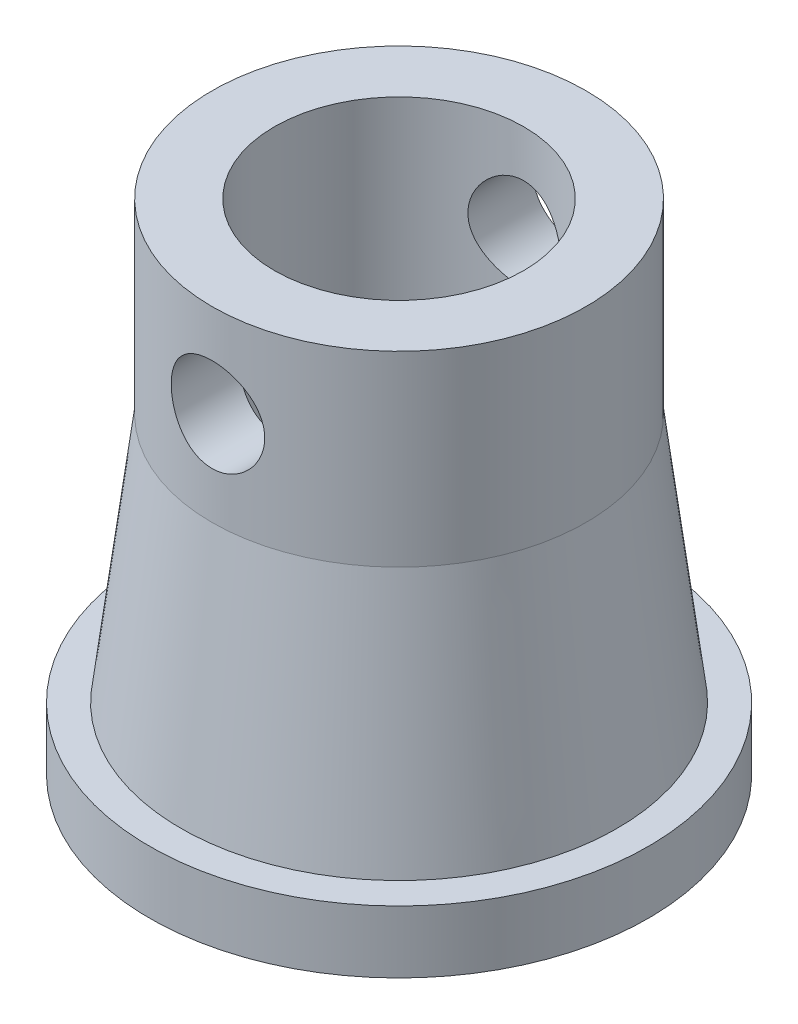
from build123d import *

# Parameters (mm, degrees)
SKETCH2_R          = 7.5
CUT_EXTRUDE1_DEPTH = 35


with BuildPart() as part:
    # Sketch1 → Revolve1 (revolve)
    with BuildSketch(Plane.XY, mode=Mode.PRIVATE) as revolve1_sk:
        Polygon((20, 0), (20, 80), (30, 80), (30, 50), (35, 10), (40, 10), (40, 0), align=None)
    revolve(revolve1_sk.sketch.rotate(Axis((0, 0, 0), (0, 1, 0)), 90), axis=Axis((0, 0, 0), (0, 1, 0)))

    # Sketch2 → Cut-Extrude1 (cut, symmetric)
    with BuildSketch(Plane.XY):
        with Locations((0, 65)):
            Circle(SKETCH2_R)
    extrude(amount=CUT_EXTRUDE1_DEPTH, both=True, mode=Mode.SUBTRACT)


solid = part.part
